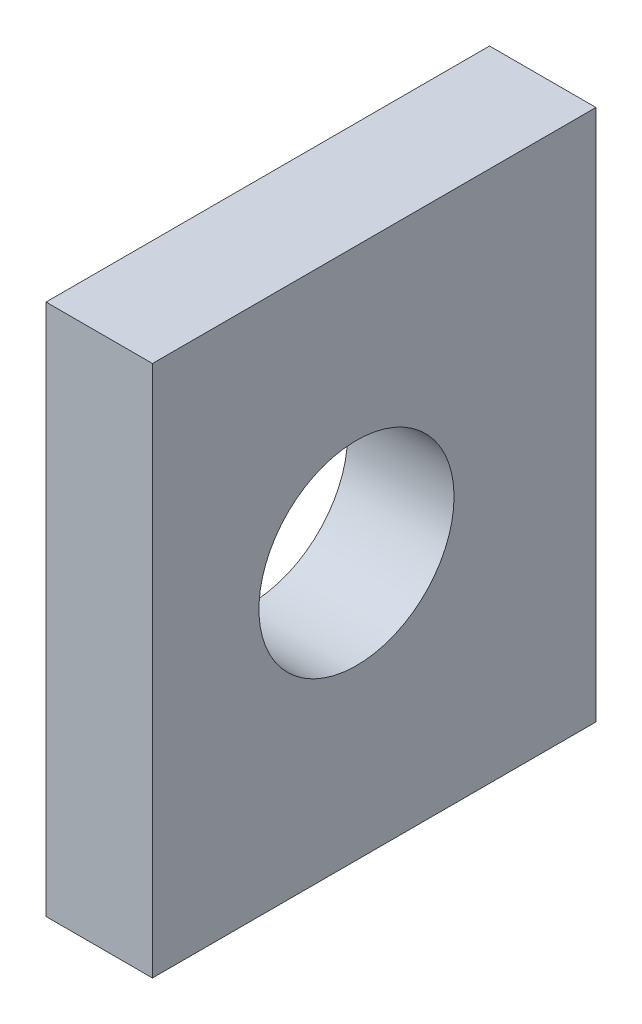
from build123d import *

# Parameters (mm, degrees)
SKETCH1_W           = 50
SKETCH1_H           = 60
BOSS_EXTRUDE1_DEPTH = 12
SKETCH2_R           = 11
CUT_EXTRUDE1_DEPTH  = 32


with BuildPart() as part:
    # Sketch1 → Boss-Extrude1 (new body)
    with BuildSketch(Plane(origin=(513, 0, 0), x_dir=(0, 0, -1), z_dir=(1, 0, 0))):
        with Locations((-155, 300)):
            Rectangle(SKETCH1_W, SKETCH1_H)
    extrude(amount=BOSS_EXTRUDE1_DEPTH)

    # Sketch2 → Cut-Extrude1 (cut)
    with BuildSketch(Plane(origin=(525, 0, 0), x_dir=(0, 0, -1), z_dir=(1, 0, 0))):
        with Locations((-157, 300)):
            Circle(SKETCH2_R)
    extrude(amount=-CUT_EXTRUDE1_DEPTH, mode=Mode.SUBTRACT)


solid = part.part
